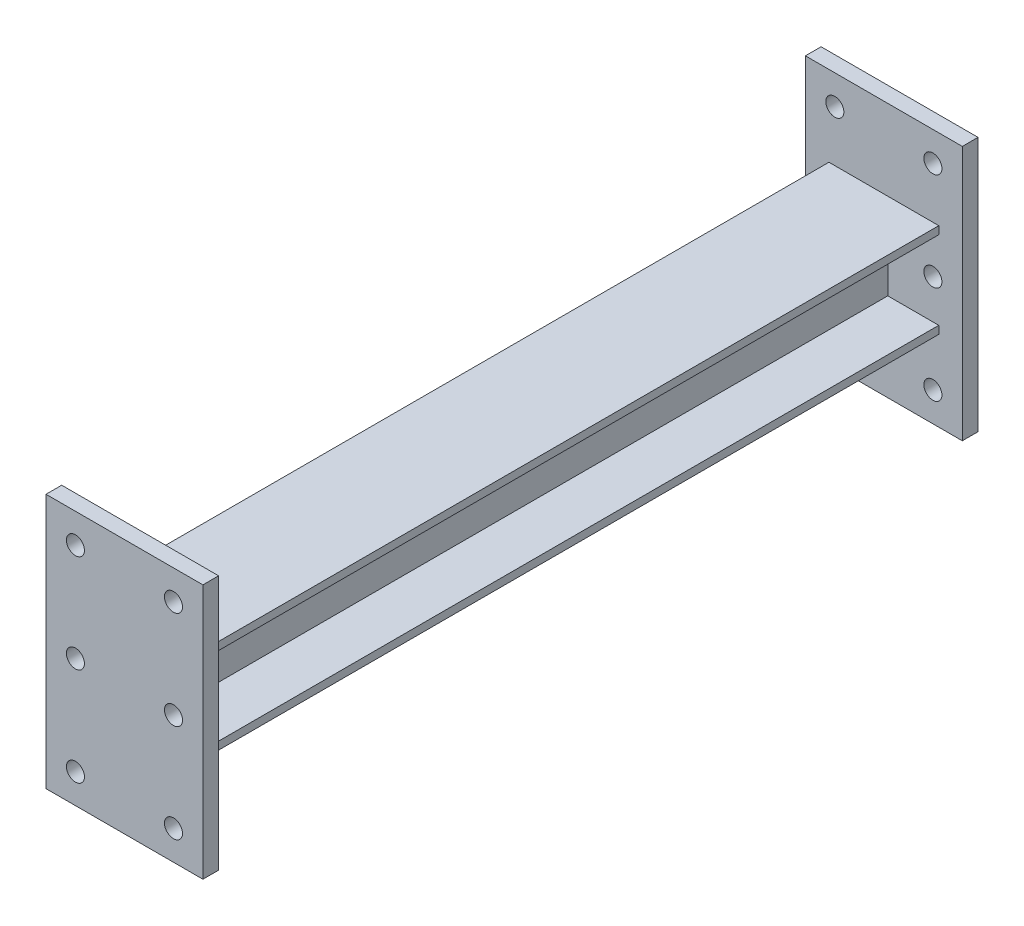
from build123d import *

# Parameters (mm, degrees)
EXTRUDE_1_DEPTH             = 948
SKETCH_2_W                  = 200
SKETCH_2_H                  = 325
EXTRUDE_2_DEPTH             = 20
SKETCH_3_W                  = 200
SKETCH_3_H                  = 325
EXTRUDE_3_DEPTH             = 20
SKETCH_4_R                  = 11.5
CUT_EXTRUDE_1_DEPTH         = 1027.912970996
PATTERN_LINEAR_1_COUNT      = 2
PATTERN_LINEAR_1_PITCH      = 125
PATTERN_LINEAR_1_COUNT_DIR2 = 3
PATTERN_LINEAR_1_PITCH_DIR2 = 125


with BuildPart() as part:
    # 草图1 → 凸台-拉伸1 (new body)
    with BuildSketch(Plane.XY):
        Polygon((0, 120), (0, 110), (65, 110), (65, 10), (0, 10), (0, 0), (140, 0), (140, 10), (75, 10), (75, 110), (140, 110), (140, 120), align=None)
    extrude(amount=EXTRUDE_1_DEPTH)

    # 草图2 → 凸台-拉伸2 (add)
    with BuildSketch(Plane.XY.offset(948)):
        with Locations((70, 60)):
            Rectangle(SKETCH_2_W, SKETCH_2_H)
    extrude(amount=EXTRUDE_2_DEPTH)

    # 草图3 → 凸台-拉伸3 (add)
    with BuildSketch(Plane(origin=(0, 0, 0), x_dir=(-1, 0, 0), z_dir=(0, 0, -1))):
        with Locations((-70, 60)):
            Rectangle(SKETCH_3_W, SKETCH_3_H)
    extrude(amount=EXTRUDE_3_DEPTH)

    # 草图4 → 切除-拉伸1 (cut, through all)
    with BuildSketch(Plane.XY.offset(968)):
        with Locations((7.5, 185)):
            Circle(SKETCH_4_R)
    cut_extrude_1 = extrude(amount=-CUT_EXTRUDE_1_DEPTH, mode=Mode.SUBTRACT)

    # 阵列(线性)1: Cut-Extrude 1 2 × 3
    with Locations(*[(i * PATTERN_LINEAR_1_PITCH, -j * PATTERN_LINEAR_1_PITCH_DIR2, 0) for i in range(PATTERN_LINEAR_1_COUNT) for j in range(PATTERN_LINEAR_1_COUNT_DIR2) if (i, j) != (0, 0)]):
        add(cut_extrude_1, mode=Mode.SUBTRACT)


solid = part.part
